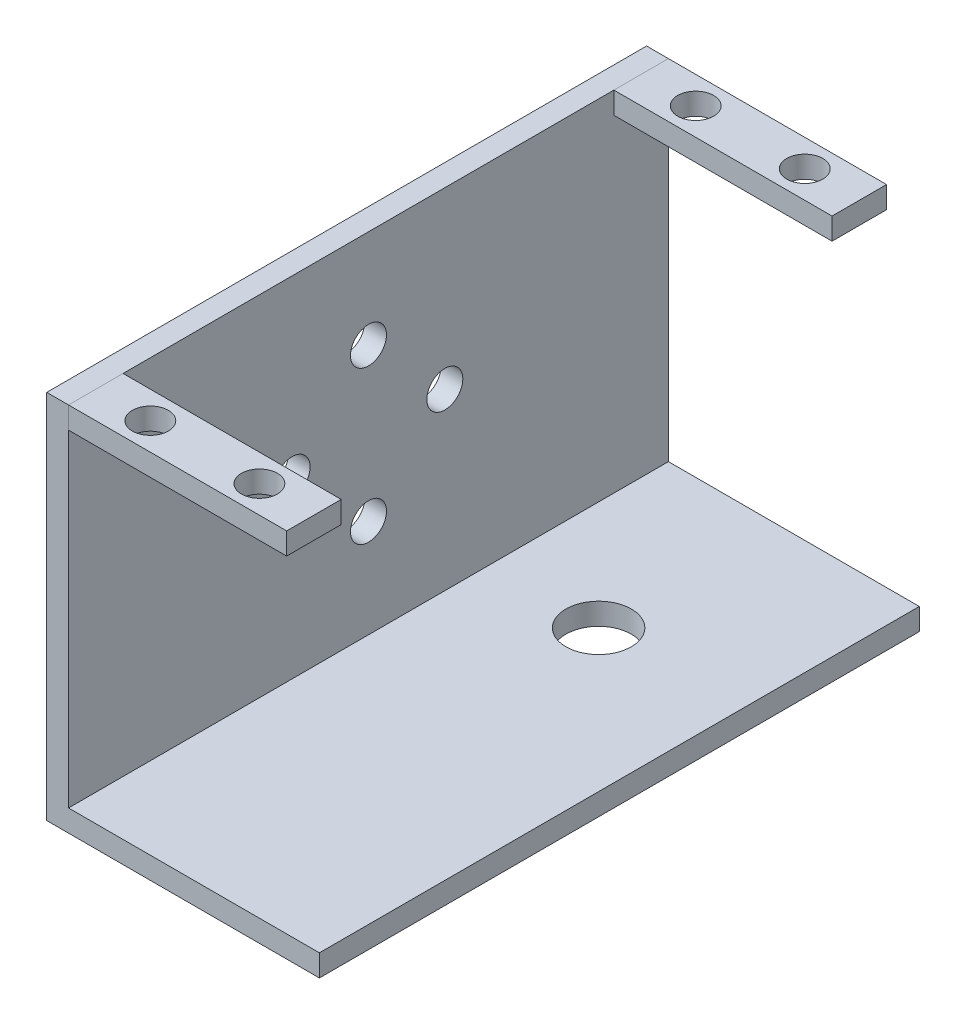
from build123d import *

# Parameters (mm, degrees)
SKETCH_1_W          = 25
SKETCH_1_H          = 55
EXTRUDE_1_DEPTH     = 2
SKETCH_3_W          = 2
SKETCH_3_H          = 55
EXTRUDE_2_DEPTH     = 32
SKETCH_4_W          = 5
SKETCH_4_H          = 2
EXTRUDE_3_DEPTH     = 20
EXTRUDE_3_2_DEPTH   = 20
SKETCH_5_R          = 1.65
CUT_EXTRUDE_2_DEPTH = 2
SKETCH_6_R          = 1.65
CUT_EXTRUDE_3_DEPTH = 10
SKETCH_7_R          = 3
CUT_EXTRUDE_4_DEPTH = 10


with BuildPart() as part:
    # 草图1 → 凸台-拉伸1 (new body)
    with BuildSketch(Plane(origin=(0, 0, 0), x_dir=(1, 0, 0), z_dir=(0, 1, 0))):
        Rectangle(SKETCH_1_W, SKETCH_1_H)
    extrude(amount=EXTRUDE_1_DEPTH)

    # 草图3 → 凸台-拉伸2 (add)
    with BuildSketch(Plane(origin=(0, 2, 0), x_dir=(1, 0, 0), z_dir=(0, 1, 0))):
        with Locations((-11.5, 0)):
            Rectangle(SKETCH_3_W, SKETCH_3_H)
    extrude(amount=EXTRUDE_2_DEPTH)

    # 草图6 → 切除-拉伸3 (cut)
    with BuildSketch(Plane(origin=(-10.5, 0, 0), x_dir=(0, 0, -1), z_dir=(1, 0, 0))):
        with Locations((-7, 18)):
            Circle(SKETCH_6_R)
        with Locations((7, 18)):
            Circle(SKETCH_6_R)
        with Locations((0, 25)):
            Circle(SKETCH_6_R)
        with Locations((0, 11)):
            Circle(SKETCH_6_R)
    extrude(amount=-CUT_EXTRUDE_3_DEPTH, mode=Mode.SUBTRACT)

    # 草图7 → 切除-拉伸4 (cut)
    with BuildSketch(Plane(origin=(0, 2, 0), x_dir=(1, 0, 0), z_dir=(0, 1, 0))):
        with Locations(Location((-0.5, 11.1, 0), (0, 0, 270))):
            Circle(SKETCH_7_R)
    extrude(amount=-CUT_EXTRUDE_4_DEPTH, mode=Mode.SUBTRACT)


with BuildPart() as body_2:
    # 草图4 → 凸台-拉伸3 (new body)
    with BuildSketch(Plane(origin=(-10.5, 0, 0), x_dir=(0, 0, -1), z_dir=(1, 0, 0))):
        with Locations((25, 33)):
            Rectangle(SKETCH_4_W, SKETCH_4_H)
    extrude(amount=EXTRUDE_3_DEPTH)


with BuildPart() as body_3:
    # 草图4 → Extrude 3 2 (new body)
    with BuildSketch(Plane(origin=(-10.5, 0, 0), x_dir=(0, 0, -1), z_dir=(1, 0, 0))):
        with Locations((-25, 33)):
            Rectangle(SKETCH_4_W, SKETCH_4_H)
    extrude(amount=EXTRUDE_3_2_DEPTH)


with BuildPart() as cut_extrude_2_tool:
    # 草图5 → 切除-拉伸2 (new body)
    with BuildSketch(Plane(origin=(0, 34, 0), x_dir=(1, 0, 0), z_dir=(0, 1, 0))):
        with Locations(Location((-5.5, -25, 0), (0, 0, 270))):
            Circle(SKETCH_5_R)
        with Locations(Location((4.5, -25, 0), (0, 0, 270))):
            Circle(SKETCH_5_R)
        with Locations(Location((4.5, 25, 0), (0, 0, 270))):
            Circle(SKETCH_5_R)
        with Locations(Location((-5.5, 25, 0), (0, 0, 270))):
            Circle(SKETCH_5_R)
    extrude(amount=-CUT_EXTRUDE_2_DEPTH)


with BuildPart() as body_2_1:
    add(body_2.part)

    # 切除-拉伸2: cut by cut_extrude_2_tool
    add(cut_extrude_2_tool.part, mode=Mode.SUBTRACT)


with BuildPart() as body_3_1:
    add(body_3.part)

    # 切除-拉伸2: cut by cut_extrude_2_tool
    add(cut_extrude_2_tool.part, mode=Mode.SUBTRACT)


solid = Compound([part.part, body_2_1.part, body_3_1.part])
